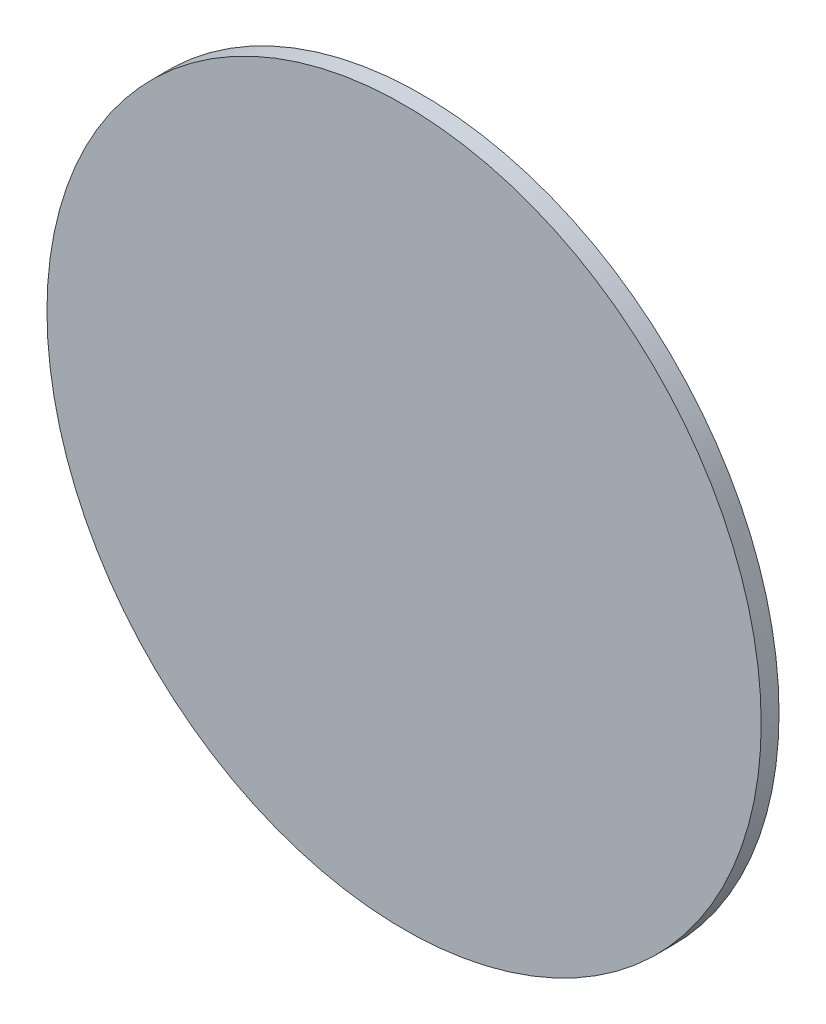
from build123d import *

# Parameters (mm, degrees)
SKETCH1_R           = 95.25
BOSS_EXTRUDE1_DEPTH = 4.7625


with BuildPart() as part:
    # Sketch1 → Boss-Extrude1 (new body)
    with BuildSketch(Plane.XY):
        Circle(SKETCH1_R)
    extrude(amount=BOSS_EXTRUDE1_DEPTH)


solid = part.part
